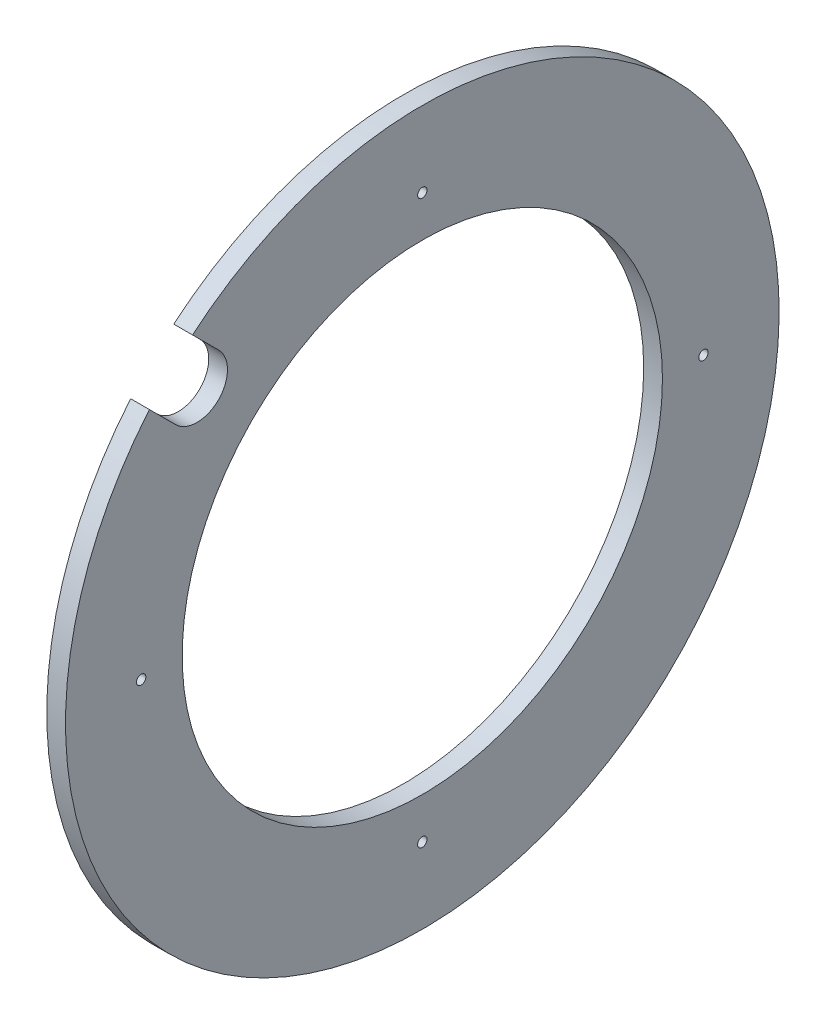
from build123d import *

# Parameters (mm, degrees)
ESQUISSE1_R        = 76.15
ESQUISSE1_R_2      = 51.25
BOSS_EXTRU_1_DEPTH = 4
SKETCH1_R          = 1
AIR_VENTS_DEPTH    = 108.766622848
CUT_EXTRUDE1_DEPTH = 10


with BuildPart() as part:
    # Esquisse1 → Boss.-Extru.1 (new body)
    with BuildSketch(Plane(origin=(0, 0, 0), x_dir=(0, 0, -1), z_dir=(1, 0, 0))):
        Circle(ESQUISSE1_R)
        Circle(ESQUISSE1_R_2, mode=Mode.SUBTRACT)
    extrude(amount=BOSS_EXTRU_1_DEPTH)

    # Sketch1 → air vents (cut, through all)
    with BuildSketch(Plane(origin=(4, 0, 0), x_dir=(0, 0, -1), z_dir=(1, 0, 0))):
        with Locations((0, 60)):
            Circle(SKETCH1_R)
        with Locations((60, 0)):
            Circle(SKETCH1_R)
        with Locations((0, -60)):
            Circle(SKETCH1_R)
        with Locations((-60, 0)):
            Circle(SKETCH1_R)
    extrude(amount=-AIR_VENTS_DEPTH, mode=Mode.SUBTRACT)

    # Sketch2 → Cut-Extrude1 (cut)
    with BuildSketch(Plane(origin=(4, 0, 0), x_dir=(0, 0, -1), z_dir=(1, 0, 0))):
        with BuildLine():
            Line((-43.487067043, 52.679455198), (-81.600352415, 90.79274057))
            Line((-81.600352415, 90.79274057), (-92.273966974, 83.081578819))
            Line((-92.273966974, 83.081578819), (-52.679455198, 43.487067043))
            ThreePointArc((-52.679455198, 43.487067043), (-43.487067043, 43.487067043), (-43.487067043, 52.679455198))
        make_face()
    extrude(amount=-CUT_EXTRUDE1_DEPTH, mode=Mode.SUBTRACT)


solid = part.part
